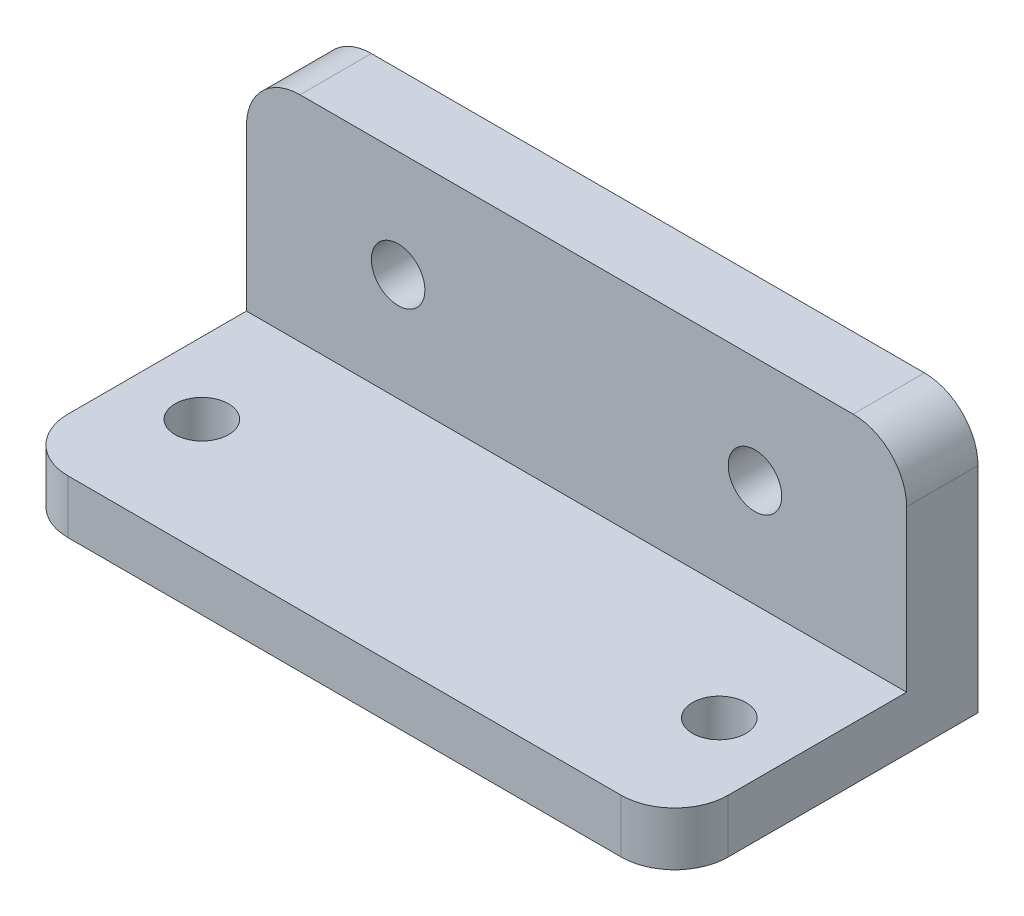
from build123d import *

# Parameters (mm, degrees)
SKETCH_2_W          = 37
SKETCH_2_H          = 13
EXTRUDE_2_DEPTH     = 3
SKETCH_3_R          = 1.5
CUT_EXTRUDE_2_DEPTH = 3
SKETCH_4_W          = 37
SKETCH_4_H          = 4
EXTRUDE_3_DEPTH     = 15
FILLET_4_R          = 3
FILLET_5_R          = 3
SKETCH_5_R          = 1.5
CUT_EXTRUDE_3_DEPTH = 10
FILLET_6_R          = 3


with BuildPart() as part:
    # 草图2 → 凸台-拉伸2 (new body)
    with BuildSketch(Plane(origin=(0, 0, 0), x_dir=(1, 0, 0), z_dir=(0, 1, 0))):
        Rectangle(SKETCH_2_W, SKETCH_2_H)
    extrude(amount=EXTRUDE_2_DEPTH)

    # 草图3 → 切除-拉伸2 (cut)
    with BuildSketch(Plane.XZ):
        with Locations(Location((-14.5, 0, 0), (0, 0, 270))):
            Circle(SKETCH_3_R)
        with Locations(Location((14.5, 0, 0), (0, 0, 270))):
            Circle(SKETCH_3_R)
    extrude(amount=-CUT_EXTRUDE_2_DEPTH, mode=Mode.SUBTRACT)

    # 草图4 → 凸台-拉伸3 (add)
    with BuildSketch(Plane.XZ):
        with Locations((0, -8.5)):
            Rectangle(SKETCH_4_W, SKETCH_4_H)
    extrude(amount=-EXTRUDE_3_DEPTH)

    # 圆角4
    fillet_4_edges = [part.edges().sort_by_distance(p)[0] for p in [
        (18.5, 15, -8.5),
    ]]
    fillet(fillet_4_edges, radius=FILLET_4_R)

    # 圆角5
    fillet_5_edges = [part.edges().sort_by_distance(p)[0] for p in [
        (-18.5, 15, -8.5),
    ]]
    fillet(fillet_5_edges, radius=FILLET_5_R)

    # 草图5 → 切除-拉伸3 (cut)
    with BuildSketch(Plane.XY.offset(-6.5)):
        with Locations((10, 9.01536156)):
            Circle(SKETCH_5_R)
        with Locations(Location((-10, 9.01536156, 0), (0, 0, 180))):
            Circle(SKETCH_5_R)
    extrude(amount=-CUT_EXTRUDE_3_DEPTH, mode=Mode.SUBTRACT)

    # 圆角6
    fillet_6_edges = [part.edges().sort_by_distance(p)[0] for p in [
        (-18.5, 1.5, 6.5),
        (18.5, 1.5, 6.5),
    ]]
    fillet(fillet_6_edges, radius=FILLET_6_R)


solid = part.part
